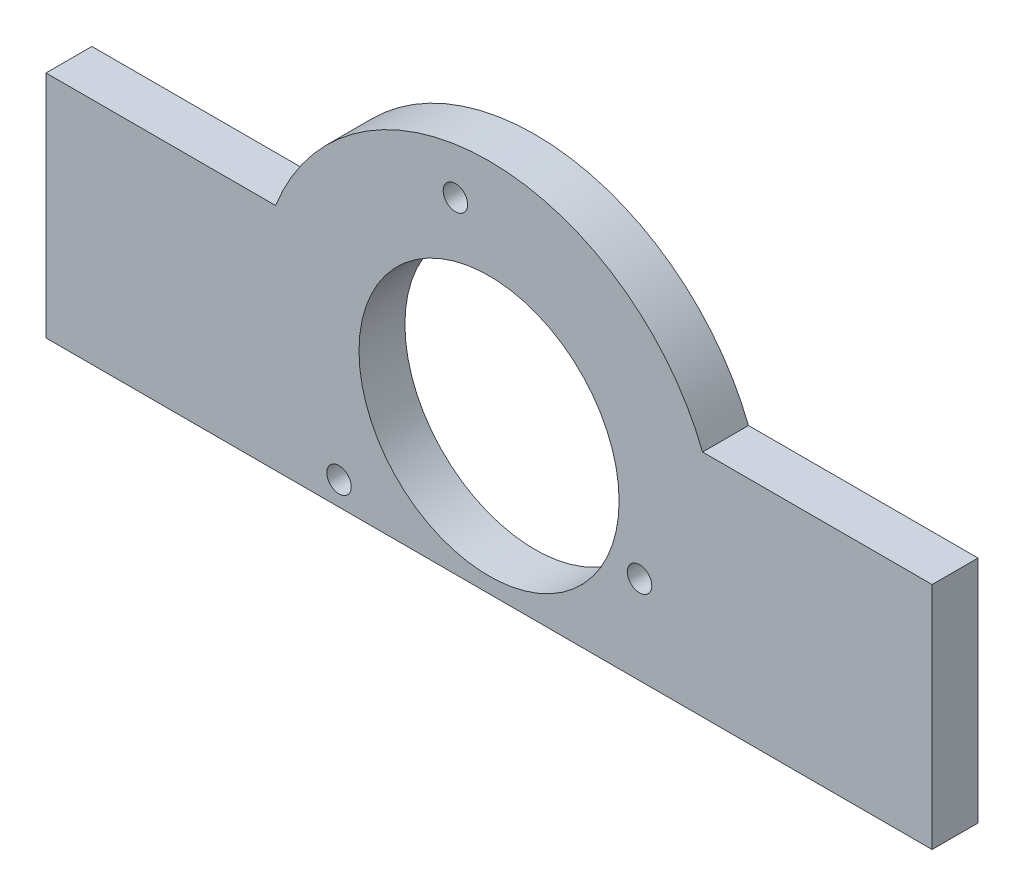
from build123d import *

# Parameters (mm, degrees)
SKETCH1_R           = 38.1
SKETCH1_R_2         = 21.59
BOSS_EXTRUDE1_DEPTH = 7.62
CUT_EXTRUDE1_DEPTH  = 55.417684625
SKETCH7_R           = 2.032
CUT_EXTRUDE2_DEPTH  = 55.417684625
BOSS_EXTRUDE2_START = -7.62
BOSS_EXTRUDE2_DEPTH = 7.62


with BuildPart() as part:
    # Sketch1 → Boss-Extrude1 (new body)
    with BuildSketch(Plane.XY):
        with Locations(Location((0, 0, 0), (0, 0, 180))):
            Circle(SKETCH1_R)
        with Locations(Location((0, 0, 0), (0, 0, 180))):
            Circle(SKETCH1_R_2, mode=Mode.SUBTRACT)
    extrude(amount=BOSS_EXTRUDE1_DEPTH)

    # Sketch2 → Cut-Extrude1 (cut, through all)
    with BuildSketch(Plane.XY.offset(7.62)):
        Polygon((0, -38.1), (-36.256055522, -38.1), (-36.256055522, -24.13), (33.75035888, -24.13), (33.75035888, -38.1), align=None)
    extrude(amount=-CUT_EXTRUDE1_DEPTH, mode=Mode.SUBTRACT)

    # Sketch7 → Cut-Extrude2 (cut, through all)
    with BuildSketch(Plane.XY.offset(7.62)):
        with Locations((-24.902829883, -20.191092866)):
            Circle(SKETCH7_R)
        with Locations((-5.581705562, 30.037407134)):
            Circle(SKETCH7_R)
        with Locations((24.982770117, -9.484666265)):
            Circle(SKETCH7_R)
    extrude(amount=-CUT_EXTRUDE2_DEPTH, mode=Mode.SUBTRACT)

    # Sketch9 → Boss-Extrude2 (add)
    with BuildSketch(Plane.XY.offset(7.62).offset(BOSS_EXTRUDE2_START)):
        Polygon((-29.484794386, -24.13), (-73.546425772, -24.13), (-73.546425772, 13.97), (-35.446425772, 13.97), align=None)
        Polygon((29.484794386, -24.13), (73.546425772, -24.13), (73.546425772, 13.97), (35.446425772, 13.97), align=None)
    extrude(amount=BOSS_EXTRUDE2_DEPTH)


solid = part.part
